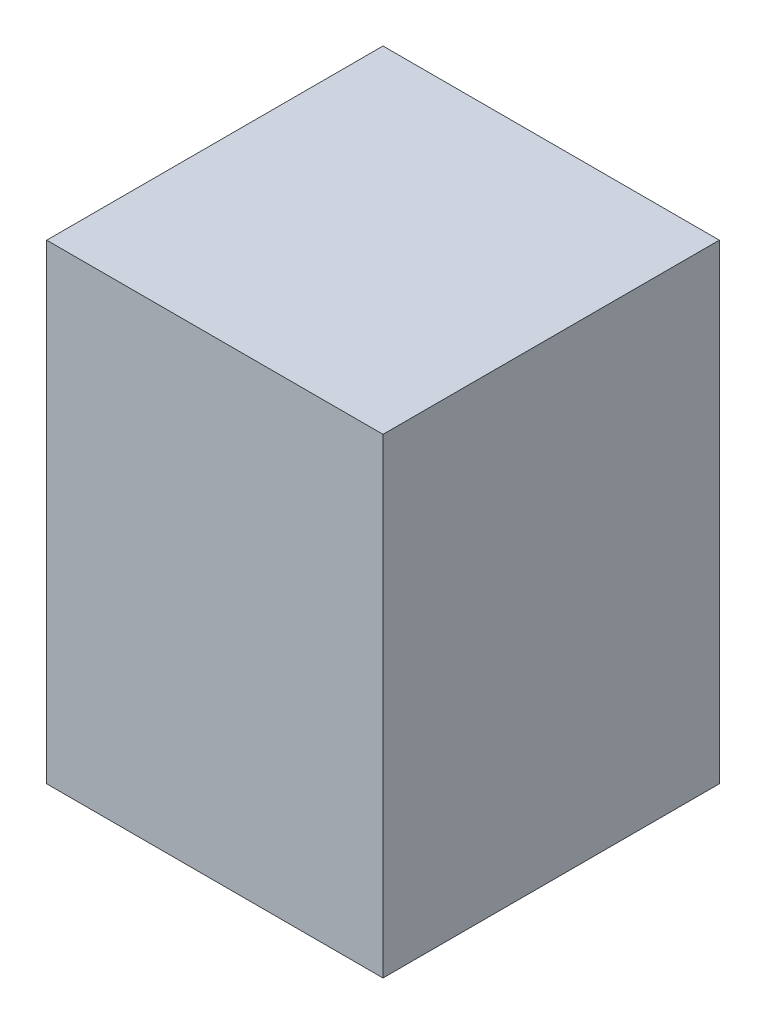
from build123d import *

# Parameters (mm, degrees)
SKETCH1_W           = 50
SKETCH1_H           = 50
BOSS_EXTRUDE1_DEPTH = 70


with BuildPart() as part:
    # Sketch1 → Boss-Extrude1 (new body)
    with BuildSketch(Plane(origin=(0, 0, 0), x_dir=(1, 0, 0), z_dir=(0, 1, 0))):
        with Locations((0, -1.325757576)):
            Rectangle(SKETCH1_W, SKETCH1_H)
    extrude(amount=-BOSS_EXTRUDE1_DEPTH)


solid = part.part
